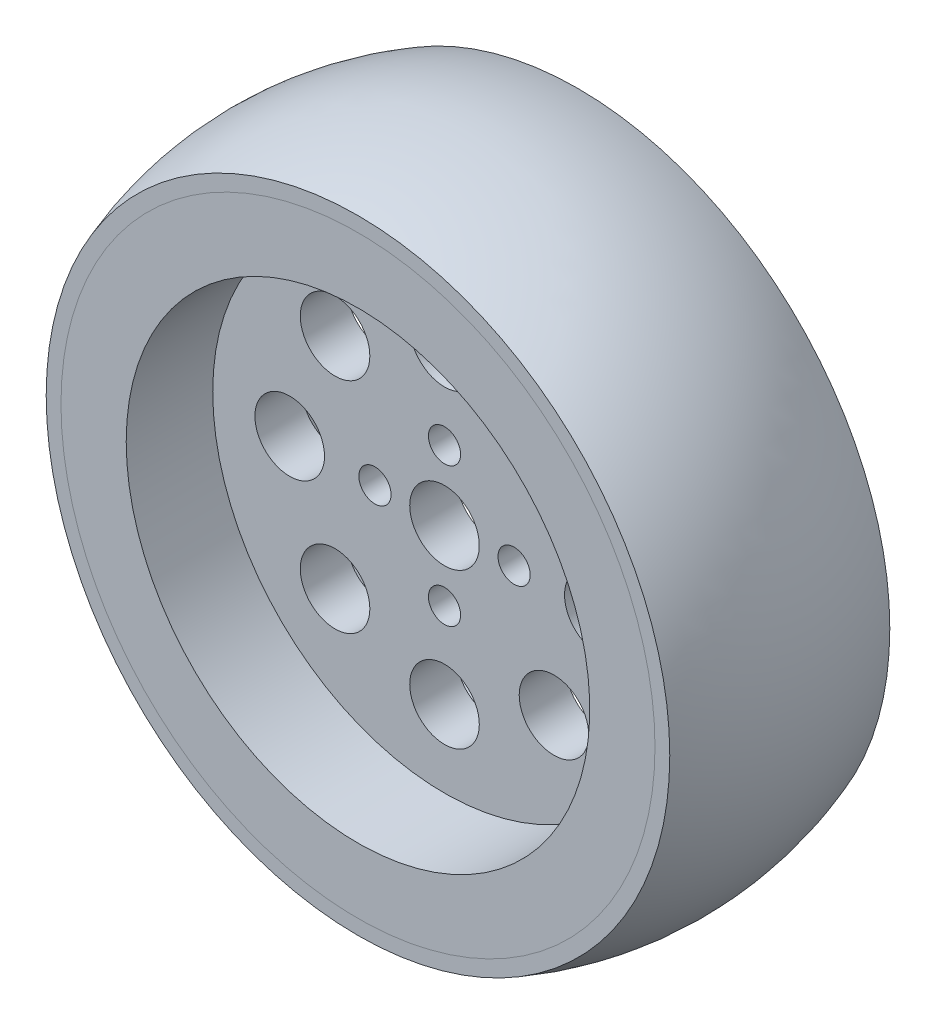
from build123d import *

# Parameters (mm, degrees)
CUT_EXTRUDE1_DEPTH      = 56.346567353
CUT_EXTRUDE1_DEPTH_BACK = 56.346567353
SKETCH3_R               = 1.85
SKETCH3_R_2             = 4


with BuildPart() as part:
    # Sketch1 → Revolve1 (revolve)
    with BuildSketch(Plane(origin=(0, 0, 0), x_dir=(1, 0, 0), z_dir=(0, 1, 0)), mode=Mode.PRIVATE) as revolve1_sk:
        Polygon((4, 2.7), (4, -2.7), (26.65, -2.7), (26.65, -12.65), (34.15, -12.65), (34.15, -10.65), (31.85, -10.65), (31.85, 10.65), (34.15, 10.65), (34.15, 12.65), (26.65, 12.65), (26.65, 2.7), align=None)
    revolve(revolve1_sk.sketch.rotate(Axis((0, 0, -12.65), (0, 0, 1)), 180), axis=Axis((0, 0, -12.65), (0, 0, 1)))

    # Sketch3 → Cut-Extrude1 (cut, two sides: drawn at the far end of the back side and taken through both)
    with BuildSketch(Plane.XY.offset(-CUT_EXTRUDE1_DEPTH_BACK)):
        with Locations((0, 8)):
            Circle(SKETCH3_R)
        with Locations((8, 0)):
            Circle(SKETCH3_R)
        with Locations((0, -8)):
            Circle(SKETCH3_R)
        with Locations((-8, 0)):
            Circle(SKETCH3_R)
        with Locations((0, 17.8)):
            Circle(SKETCH3_R_2)
        with Locations((12.586500705, 12.586500705)):
            Circle(SKETCH3_R_2)
        with Locations((17.8, 0)):
            Circle(SKETCH3_R_2)
        with Locations((12.586500705, -12.586500705)):
            Circle(SKETCH3_R_2)
        with Locations((0, -17.8)):
            Circle(SKETCH3_R_2)
        with Locations((-12.586500705, -12.586500705)):
            Circle(SKETCH3_R_2)
        with Locations((-17.8, 0)):
            Circle(SKETCH3_R_2)
        with Locations((-12.586500705, 12.586500705)):
            Circle(SKETCH3_R_2)
    extrude(amount=CUT_EXTRUDE1_DEPTH + CUT_EXTRUDE1_DEPTH_BACK, mode=Mode.SUBTRACT)


with BuildPart() as body_2:
    # Sketch2 → Revolve2 (revolve)
    with BuildSketch(Plane(origin=(0, 0, 0), x_dir=(1, 0, 0), z_dir=(0, 1, 0)), mode=Mode.PRIVATE) as revolve2_sk:
        with BuildLine():
            Line((31.85, -10.65), (31.85, 10.65))
            Line((31.85, 10.65), (34.15, 10.65))
            Line((34.15, 10.65), (34.15, 12.65))
            Line((34.15, 12.65), (35.85, 12.65))
            ThreePointArc((35.85, 12.65), (38.1, 0), (35.85, -12.65))
            Line((35.85, -12.65), (34.15, -12.65))
            Line((34.15, -12.65), (34.15, -10.65))
            Line((34.15, -10.65), (31.85, -10.65))
        make_face()
    revolve(revolve2_sk.sketch.rotate(Axis((0, 0, 0), (0, 0, 1)), 180), axis=Axis((0, 0, 0), (0, 0, 1)))


solid = Compound([part.part, body_2.part])
